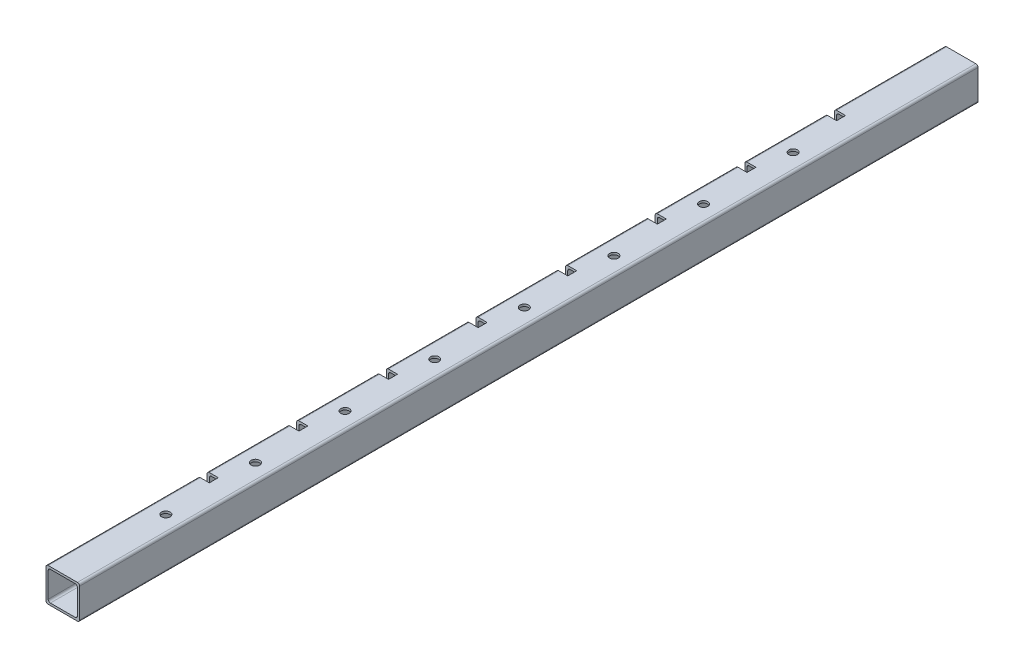
from build123d import *

# Parameters (mm, degrees)
SKETCH3_W           = 19.05
SKETCH3_H           = 19.05
SKETCH3_W_2         = 16.5608
SKETCH3_H_2         = 16.5608
BOSS_EXTRUDE1_DEPTH = 254.635
FILLET1_R           = 1.2446
CUT_EXTRUDE1_REACH  = 257.524
SKETCH4_R           = 2.413
CUT_EXTRUDE3_DEPTH  = 6.35
LPATTERN2_COUNT     = 8
LPATTERN2_PITCH     = 50.8


with BuildPart() as part:
    # Sketch3 → Boss-Extrude1 (new, symmetric)
    with BuildSketch(Plane.XY):
        Rectangle(SKETCH3_W, SKETCH3_H)
        Rectangle(SKETCH3_W_2, SKETCH3_H_2, mode=Mode.SUBTRACT)
    extrude(amount=BOSS_EXTRUDE1_DEPTH, both=True)

    # Fillet1
    fillet1_edges = [part.edges().sort_by_distance(p)[0] for p in [
        (-8.2804, -8.2804, 0),
        (8.2804, -8.2804, 0),
        (8.2804, 8.2804, 0),
        (-8.2804, 8.2804, 0),
        (9.525, -9.525, 0),
        (-9.525, -9.525, 0),
        (-9.525, 9.525, 0),
        (9.525, 9.525, 0),
    ]]
    fillet(fillet1_edges, radius=FILLET1_R)

    # Sketch4 → Cut-Extrude1 (cut, up to next)
    with BuildSketch(Plane(origin=(0, 9.525, 0), x_dir=(1, 0, 0), z_dir=(0, 1, 0)), mode=Mode.PRIVATE) as cut_extrude1_sk1:
        with Locations(Location((0, 159.385, 0), (0, 0, 270))):
            Circle(SKETCH4_R)
    cut_extrude1_tool1 = extrude(cut_extrude1_sk1.sketch, amount=-CUT_EXTRUDE1_REACH, mode=Mode.PRIVATE) & part.part
    # Sketch4 → Cut-Extrude1 (cut, up to next)
    with BuildSketch(Plane(origin=(0, 9.525, 0), x_dir=(1, 0, 0), z_dir=(0, 1, 0)), mode=Mode.PRIVATE) as cut_extrude1_sk2:
        with Locations(Location((0, 108.585, 0), (0, 0, 270))):
            Circle(SKETCH4_R)
    cut_extrude1_tool2 = extrude(cut_extrude1_sk2.sketch, amount=-CUT_EXTRUDE1_REACH, mode=Mode.PRIVATE) & part.part
    # Sketch4 → Cut-Extrude1 (cut, up to next)
    with BuildSketch(Plane(origin=(0, 9.525, 0), x_dir=(1, 0, 0), z_dir=(0, 1, 0)), mode=Mode.PRIVATE) as cut_extrude1_sk3:
        with Locations(Location((0, 57.785, 0), (0, 0, 270))):
            Circle(SKETCH4_R)
    cut_extrude1_tool3 = extrude(cut_extrude1_sk3.sketch, amount=-CUT_EXTRUDE1_REACH, mode=Mode.PRIVATE) & part.part
    # Sketch4 → Cut-Extrude1 (cut, up to next)
    with BuildSketch(Plane(origin=(0, 9.525, 0), x_dir=(1, 0, 0), z_dir=(0, 1, 0)), mode=Mode.PRIVATE) as cut_extrude1_sk4:
        with Locations(Location((0, 6.985, 0), (0, 0, 270))):
            Circle(SKETCH4_R)
    cut_extrude1_tool4 = extrude(cut_extrude1_sk4.sketch, amount=-CUT_EXTRUDE1_REACH, mode=Mode.PRIVATE) & part.part
    # Sketch4 → Cut-Extrude1 (cut, up to next)
    with BuildSketch(Plane(origin=(0, 9.525, 0), x_dir=(1, 0, 0), z_dir=(0, 1, 0)), mode=Mode.PRIVATE) as cut_extrude1_sk5:
        with Locations(Location((0, -43.815, 0), (0, 0, 270))):
            Circle(SKETCH4_R)
    cut_extrude1_tool5 = extrude(cut_extrude1_sk5.sketch, amount=-CUT_EXTRUDE1_REACH, mode=Mode.PRIVATE) & part.part
    # Sketch4 → Cut-Extrude1 (cut, up to next)
    with BuildSketch(Plane(origin=(0, 9.525, 0), x_dir=(1, 0, 0), z_dir=(0, 1, 0)), mode=Mode.PRIVATE) as cut_extrude1_sk6:
        with Locations(Location((0, -94.615, 0), (0, 0, 270))):
            Circle(SKETCH4_R)
    cut_extrude1_tool6 = extrude(cut_extrude1_sk6.sketch, amount=-CUT_EXTRUDE1_REACH, mode=Mode.PRIVATE) & part.part
    # Sketch4 → Cut-Extrude1 (cut, up to next)
    with BuildSketch(Plane(origin=(0, 9.525, 0), x_dir=(1, 0, 0), z_dir=(0, 1, 0)), mode=Mode.PRIVATE) as cut_extrude1_sk7:
        with Locations(Location((0, -145.415, 0), (0, 0, 270))):
            Circle(SKETCH4_R)
    cut_extrude1_tool7 = extrude(cut_extrude1_sk7.sketch, amount=-CUT_EXTRUDE1_REACH, mode=Mode.PRIVATE) & part.part
    # Sketch4 → Cut-Extrude1 (cut, up to next)
    with BuildSketch(Plane(origin=(0, 9.525, 0), x_dir=(1, 0, 0), z_dir=(0, 1, 0)), mode=Mode.PRIVATE) as cut_extrude1_sk8:
        with Locations(Location((0, -196.215, 0), (0, 0, 270))):
            Circle(SKETCH4_R)
    cut_extrude1_tool8 = extrude(cut_extrude1_sk8.sketch, amount=-CUT_EXTRUDE1_REACH, mode=Mode.PRIVATE) & part.part
    add(cut_extrude1_tool1.solids().sort_by_distance((0, 9.525, -159.385))[0], mode=Mode.SUBTRACT)
    add(cut_extrude1_tool2.solids().sort_by_distance((0, 9.525, -108.585))[0], mode=Mode.SUBTRACT)
    add(cut_extrude1_tool3.solids().sort_by_distance((0, 9.525, -57.785))[0], mode=Mode.SUBTRACT)
    add(cut_extrude1_tool4.solids().sort_by_distance((0, 9.525, -6.985))[0], mode=Mode.SUBTRACT)
    add(cut_extrude1_tool5.solids().sort_by_distance((0, 9.525, 43.815))[0], mode=Mode.SUBTRACT)
    add(cut_extrude1_tool6.solids().sort_by_distance((0, 9.525, 94.615))[0], mode=Mode.SUBTRACT)
    add(cut_extrude1_tool7.solids().sort_by_distance((0, 9.525, 145.415))[0], mode=Mode.SUBTRACT)
    add(cut_extrude1_tool8.solids().sort_by_distance((0, 9.525, 196.215))[0], mode=Mode.SUBTRACT)

    # Sketch6 → Cut-Extrude3 (cut)
    with BuildSketch(Plane.ZY.offset(9.525)):
        Polygon((-182.118, -1.651), (-187.198, -1.651), (-187.198, 9.525), (-192.278, 9.525), (-192.278, -6.477), (-182.118, -6.477), (-177.292, -6.477), (-177.292, -1.651), align=None)
    cut_extrude3 = extrude(amount=-CUT_EXTRUDE3_DEPTH, mode=Mode.SUBTRACT)

    # LPattern2: Cut-Extrude3 ×8
    with Locations(*[(0, 0, i * LPATTERN2_PITCH) for i in range(1, LPATTERN2_COUNT)]):
        add(cut_extrude3, mode=Mode.SUBTRACT)


solid = part.part
